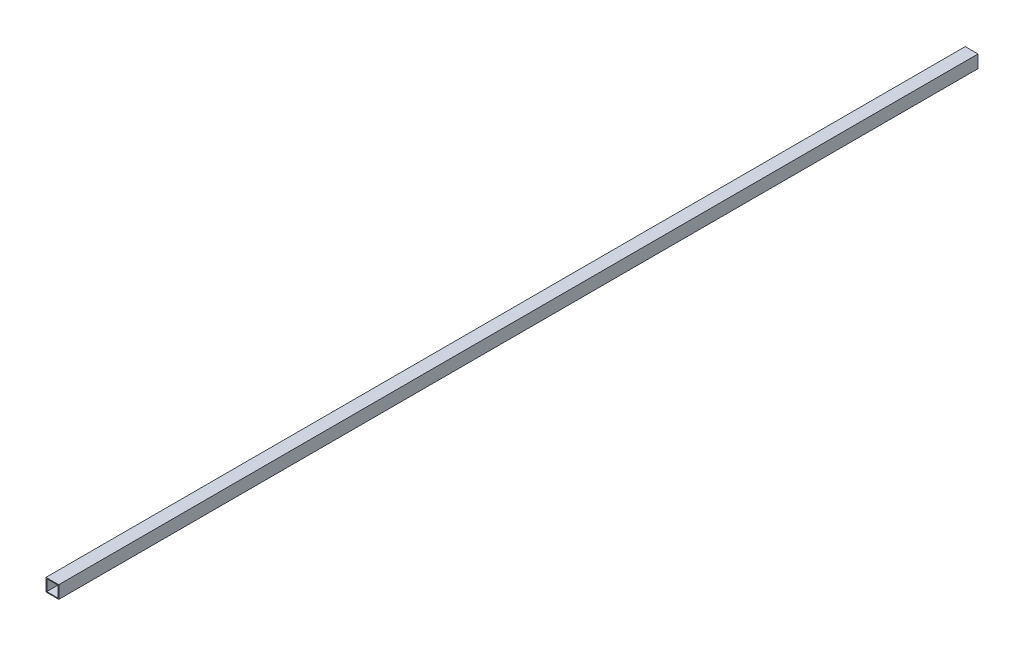
from build123d import *

# Parameters (mm, degrees)
SKETCH1_W           = 50.8
SKETCH1_H           = 50.8
BOSS_EXTRUDE1_DEPTH = 3657.6
SHELL1_T            = -3.175


with BuildPart() as part:
    # Sketch1 → Boss-Extrude1 (new body)
    with BuildSketch(Plane.XY):
        Rectangle(SKETCH1_W, SKETCH1_H)
    extrude(amount=BOSS_EXTRUDE1_DEPTH)

    # Shell1
    shell1_openings = [part.faces().sort_by_distance(p)[0] for p in [
        (0, 0, 3657.6),
        (0, 0, 0),
    ]]
    offset(amount=SHELL1_T, openings=shell1_openings, kind=Kind.INTERSECTION)


solid = part.part
